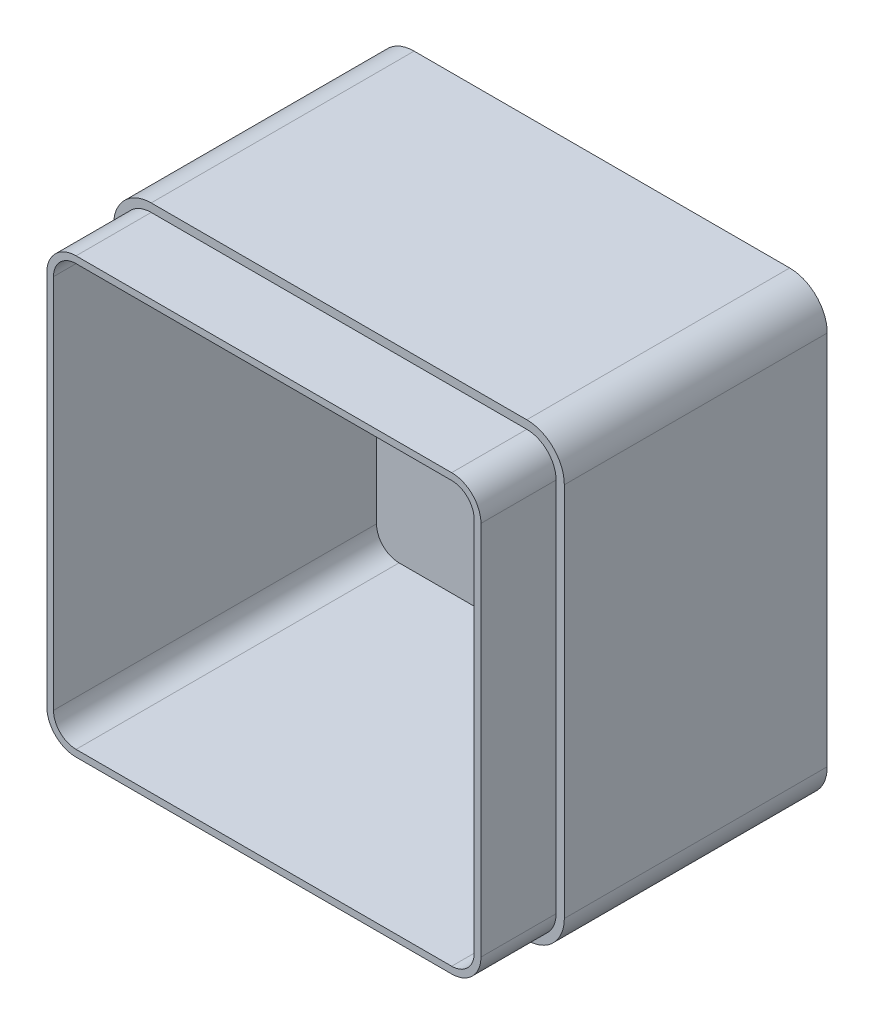
from build123d import *

# Parameters (mm, degrees)
SKETCH2_W           = 120
SKETCH2_H           = 120
BOSS_EXTRUDE1_DEPTH = 90
FILLET1_R           = 10
SHELL1_T            = -4
CUT_EXTRUDE1_DEPTH  = 20
SKETCH4_R           = 6.35
CUT_EXTRUDE2_DEPTH  = 199.773717644


with BuildPart() as part:
    # Sketch2 → Boss-Extrude1 (new body)
    with BuildSketch(Plane.XY):
        with Locations((60, 60)):
            Rectangle(SKETCH2_W, SKETCH2_H)
    extrude(amount=BOSS_EXTRUDE1_DEPTH)

    # Fillet1
    fillet1_edges = [part.edges().sort_by_distance(p)[0] for p in [
        (0, 120, 45),
        (120, 120, 45),
        (120, 0, 45),
        (0, 0, 45),
    ]]
    fillet(fillet1_edges, radius=FILLET1_R)

    # Shell1
    shell1_openings = [part.faces().sort_by_distance(p)[0] for p in [
        (60, 60, 90),
    ]]
    offset(amount=SHELL1_T, openings=shell1_openings, kind=Kind.INTERSECTION)

    # Sketch3 → Cut-Extrude1 (cut)
    with BuildSketch(Plane.XY.offset(90)):
        with BuildLine():
            Line((0, 110), (0, 10))
            ThreePointArc((0, 10), (2.928932188, 2.928932188), (10, 0))
            Line((10, 0), (110, 0))
            ThreePointArc((110, 0), (117.071067812, 2.928932188), (120, 10))
            Line((120, 10), (120, 110))
            ThreePointArc((120, 110), (117.071067812, 117.071067812), (110, 120))
            Line((110, 120), (10, 120))
            ThreePointArc((10, 120), (2.928932188, 117.071067812), (0, 110))
        make_face()
        with BuildLine():
            Line((2.2, 110), (2.2, 10))
            ThreePointArc((2.2, 10), (4.484567107, 4.484567107), (10, 2.2))
            Line((10, 2.2), (110, 2.2))
            ThreePointArc((110, 2.2), (115.515432893, 4.484567107), (117.8, 10))
            Line((117.8, 10), (117.8, 110))
            ThreePointArc((117.8, 110), (115.515432893, 115.515432893), (110, 117.8))
            Line((110, 117.8), (10, 117.8))
            ThreePointArc((10, 117.8), (4.484567107, 115.515432893), (2.2, 110))
        make_face(mode=Mode.SUBTRACT)
    extrude(amount=-CUT_EXTRUDE1_DEPTH, mode=Mode.SUBTRACT)

    # Sketch4 → Cut-Extrude2 (cut, through all)
    with BuildSketch(Plane(origin=(92.802964226, -8.446878735, 120), x_dir=(1, 0, 0), z_dir=(0, 0, 1))):
        with Locations((-73.752964226, 109.396878735)):
            Circle(SKETCH4_R)
    extrude(amount=-CUT_EXTRUDE2_DEPTH, mode=Mode.SUBTRACT)


solid = part.part
